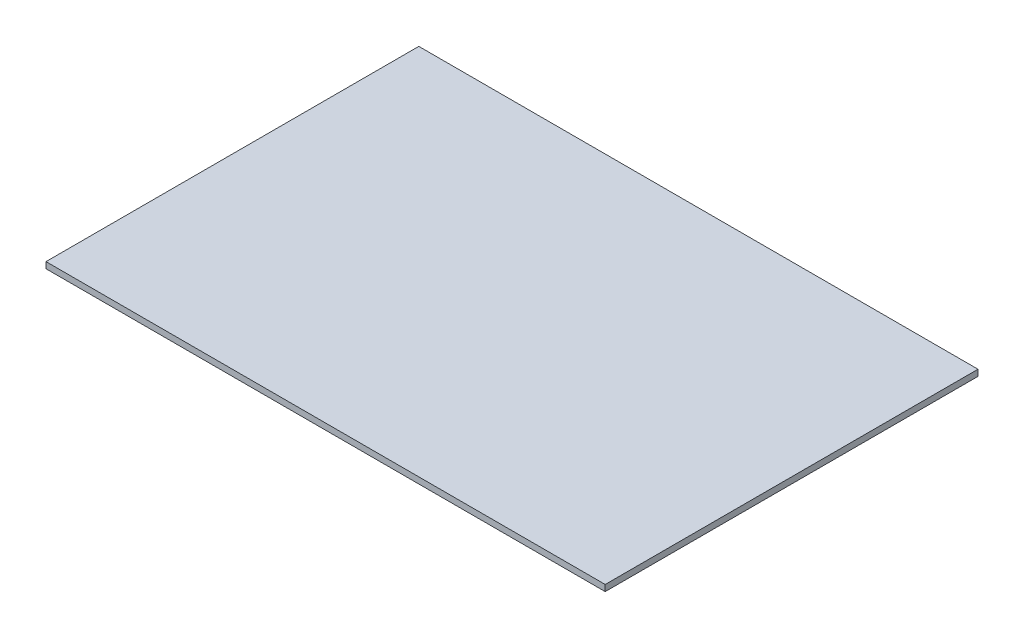
from build123d import *

# Parameters (mm, degrees)
SKETCH1_W           = 90
SKETCH1_H           = 60
BOSS_EXTRUDE1_DEPTH = 1


with BuildPart() as part:
    # Sketch1 → Boss-Extrude1 (new body)
    with BuildSketch(Plane(origin=(0, 0, 0), x_dir=(1, 0, 0), z_dir=(0, 1, 0))):
        Rectangle(SKETCH1_W, SKETCH1_H)
    extrude(amount=BOSS_EXTRUDE1_DEPTH)


solid = part.part
